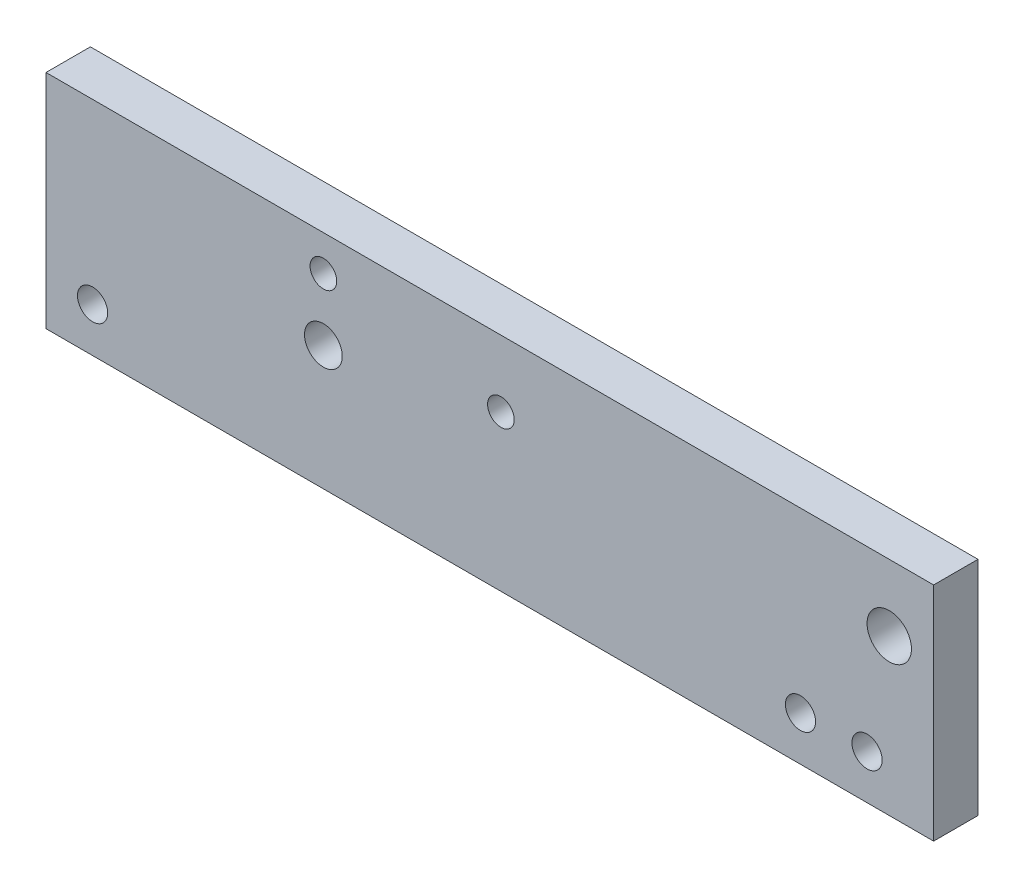
from build123d import *

# Parameters (mm, degrees)
SKETCH1_W           = 200
SKETCH1_H           = 50
BOSS_EXTRUDE1_DEPTH = 10
SKETCH2_R           = 5
SKETCH2_R_2         = 3
SKETCH2_R_3         = 4.25
CUT_EXTRUDE1_DEPTH  = 104.561575886
SKETCH3_R           = 3.4
CUT_EXTRUDE2_DEPTH  = 104.561575886


with BuildPart() as part:
    # Sketch1 → Boss-Extrude1 (new body)
    with BuildSketch(Plane.XY):
        Rectangle(SKETCH1_W, SKETCH1_H)
    extrude(amount=BOSS_EXTRUDE1_DEPTH)

    # Sketch2 → Cut-Extrude1 (cut, through all)
    with BuildSketch(Plane.XY.offset(10)):
        with Locations((90, 10)):
            Circle(SKETCH2_R)
        with Locations((2.5, 10)):
            Circle(SKETCH2_R_2)
        with Locations((-37.5, 17)):
            Circle(SKETCH2_R_2)
        with Locations((-37.5, 3)):
            Circle(SKETCH2_R_3)
    extrude(amount=-CUT_EXTRUDE1_DEPTH, mode=Mode.SUBTRACT)

    # Sketch3 → Cut-Extrude2 (cut, through all)
    with BuildSketch(Plane.XY.offset(10)):
        with Locations((-89.5, -15)):
            Circle(SKETCH3_R)
        with Locations((70, -15)):
            Circle(SKETCH3_R)
        with Locations((85, -15)):
            Circle(SKETCH3_R)
    extrude(amount=-CUT_EXTRUDE2_DEPTH, mode=Mode.SUBTRACT)


solid = part.part
